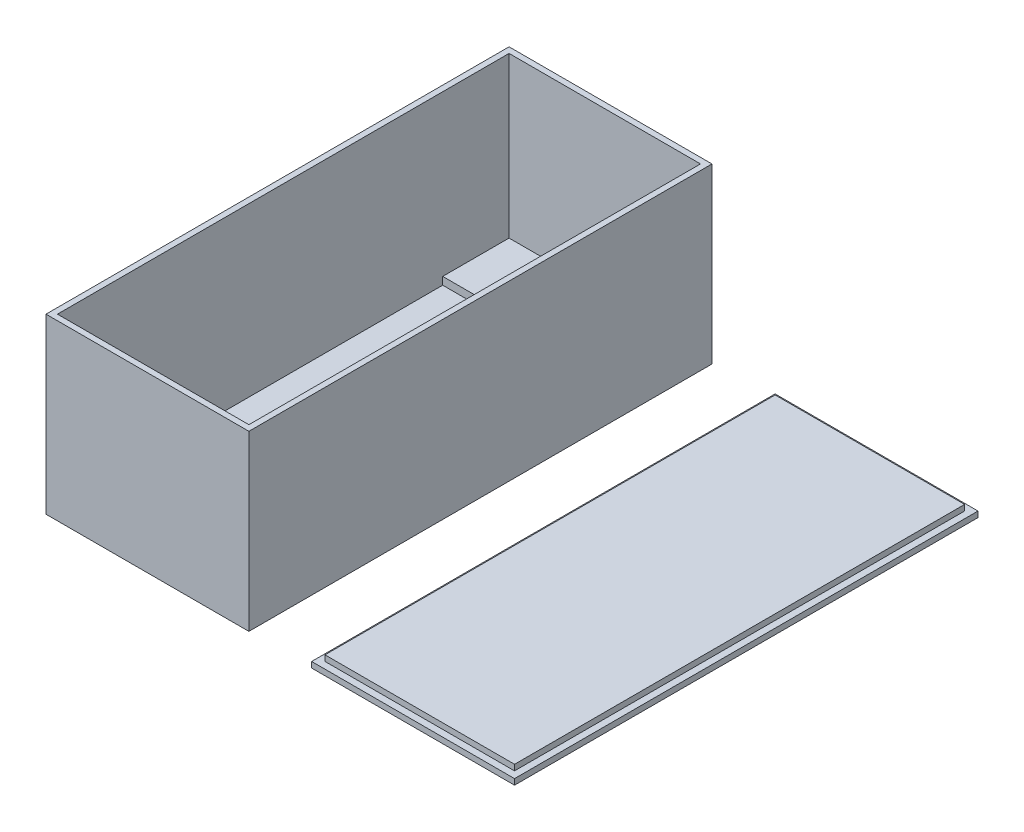
from build123d import *

# Parameters (mm, degrees)
ESBO_O1_W                 = 42.5
ESBO_O1_H                 = 97
RESSALTO_EXTRUS_O2_DEPTH  = 36.3
ESBO_O2_W                 = 40.1
ESBO_O2_H                 = 94.6
CORTE_EXTRUS_O1_DEPTH     = 35.1
ESBO_O3_R                 = 3.4
ESBO_O3_R_2               = 1
ESBO_O3_R_3               = 2.8
CORTE_EXTRUS_O2_DEPTH     = 86.729869764
RESSALTO_EXTRUS_O6_START  = 1.6
ESBO_O5_W                 = 40.1
ESBO_O5_H                 = 13.9
ESBO_O5_R                 = 3.4
ESBO_O5_R_2               = 3.870741489
ESBO_O5_R_3               = 6.1
RESSALTO_EXTRUS_O6_DEPTH  = 1.6
RESSALTO_EXTRUS_O8_START  = 6
ESBO_O5_7_R               = 3.870741489
ESBO_O5_7_R_2             = 2.8
ESBO_O5_7_R_3             = 6.9
ESBO_O5_7_R_4             = 6.1
RESSALTO_EXTRUS_O8_DEPTH  = 6
ESBO_O6_W                 = 42.5
ESBO_O6_H                 = 97.082250683
RESSALTO_EXTRUS_O11_DEPTH = 1.2
ESBO_O6_4_W               = 39.7
ESBO_O6_4_H               = 94.282250683
RESSALTO_EXTRUS_O12_DEPTH = 1.2
ESBO_O6_5_W               = 39.7
ESBO_O6_5_H               = 94.282250683
RESSALTO_EXTRUS_O13_DEPTH = 2.4
ESBO_O1_8_R               = 1.6
ESBO_O1_8_W               = 1.5
ESBO_O1_8_H               = 3
CORTE_EXTRUS_O10_DEPTH    = 87.274966516
ESBO_O1_10_W              = 14.256
ESBO_O1_10_H              = 5.4
ESBO_O1_10_W_2            = 1.5
ESBO_O1_10_H_2            = 3
ESBO_O1_10_W_3            = 6
ESBO_O1_10_H_3            = 15.2
ESBO_O1_10_R              = 1.6
RESSALTO_EXTRUS_O14_DEPTH = 2.8


with BuildPart() as part:
    # Esboço1 → Ressalto-extrusão2 (new body)
    with BuildSketch(Plane(origin=(0, 0, 0), x_dir=(1, 0, 0), z_dir=(0, 1, 0))):
        with Locations((-39.655491882, -0.572615871)):
            Rectangle(ESBO_O1_W, ESBO_O1_H)
    extrude(amount=RESSALTO_EXTRUS_O2_DEPTH)

    # Esboço2 → Corte-extrusão1 (cut)
    with BuildSketch(Plane(origin=(0, 36.3, 0), x_dir=(1, 0, 0), z_dir=(0, 1, 0))):
        with Locations((-39.655491882, -0.572615871)):
            Rectangle(ESBO_O2_W, ESBO_O2_H)
    extrude(amount=-CORTE_EXTRUS_O1_DEPTH, mode=Mode.SUBTRACT)

    # Esboço3 → Corte-extrusão2 (cut, through all)
    with BuildSketch(Plane(origin=(0, 1.2, 0), x_dir=(1, 0, 0), z_dir=(0, 1, 0))):
        with Locations((-49.680491882, 39.727384129)):
            Circle(ESBO_O3_R)
        with Locations((-29.630491882, 39.727384129)):
            Circle(ESBO_O3_R_2)
        with Locations((-39.655491882, 39.727384129)):
            Circle(ESBO_O3_R_3)
    extrude(amount=-CORTE_EXTRUS_O2_DEPTH, mode=Mode.SUBTRACT)

    # Esboço5 → Ressalto-extrusão6 (add)
    with BuildSketch(Plane(origin=(0, 1.2, 0), x_dir=(1, 0, 0), z_dir=(0, 1, 0)).offset(RESSALTO_EXTRUS_O6_START)):
        with Locations((-39.655491882, 39.777384129)):
            Rectangle(ESBO_O5_W, ESBO_O5_H)
        with Locations((-49.680491882, 39.727384129)):
            Circle(ESBO_O5_R, mode=Mode.SUBTRACT)
        with Locations((-39.655491882, 39.727384129)):
            Circle(ESBO_O5_R_2, mode=Mode.SUBTRACT)
        with Locations((-29.630491882, 39.727384129)):
            Circle(ESBO_O5_R_3, mode=Mode.SUBTRACT)
    extrude(amount=-RESSALTO_EXTRUS_O6_DEPTH)

    # Esboço5<7> → Ressalto-extrusão8 (add)
    # profile 1 of 2: a face of its own
    with BuildSketch(Plane(origin=(0, 1.2, 0), x_dir=(1, 0, 0), z_dir=(0, 1, 0)).offset(RESSALTO_EXTRUS_O8_START)):
        with Locations((-39.655491882, 39.727384129)):
            Circle(ESBO_O5_7_R)
        with Locations((-39.655491882, 39.727384129)):
            Circle(ESBO_O5_7_R_2, mode=Mode.SUBTRACT)
    # profile 2 of 2: a face of its own
    with BuildSketch(Plane(origin=(0, 1.2, 0), x_dir=(1, 0, 0), z_dir=(0, 1, 0)).offset(RESSALTO_EXTRUS_O8_START)):
        with Locations((-29.630491882, 39.727384129)):
            Circle(ESBO_O5_7_R_3)
        with Locations((-29.630491882, 39.727384129)):
            Circle(ESBO_O5_7_R_4, mode=Mode.SUBTRACT)
    extrude(amount=-RESSALTO_EXTRUS_O8_DEPTH)

    # Esboço1<8> → Corte-extrusão10 (cut, through all)
    with BuildSketch(Plane(origin=(0, 0, 0), x_dir=(1, 0, 0), z_dir=(0, 1, 0))):
        with Locations((-39.655491882, -37.072615871)):
            Circle(ESBO_O1_8_R)
        with Locations((-43.405491882, -42.572615871)):
            Rectangle(ESBO_O1_8_W, ESBO_O1_8_H)
        with Locations((-35.905491882, -42.572615871)):
            Rectangle(ESBO_O1_8_W, ESBO_O1_8_H)
    extrude(amount=CORTE_EXTRUS_O10_DEPTH, mode=Mode.SUBTRACT)

    # Esboço1<10> → Ressalto-extrusão14 (add)
    # profile 1 of 2: a face of its own
    with BuildSketch(Plane(origin=(0, 0, 0), x_dir=(1, 0, 0), z_dir=(0, 1, 0))):
        with Locations((-39.655491882, -42.572615871)):
            Rectangle(ESBO_O1_10_W, ESBO_O1_10_H)
        with Locations((-43.405491882, -42.572615871)):
            Rectangle(ESBO_O1_10_W_2, ESBO_O1_10_H_2, mode=Mode.SUBTRACT)
        with Locations((-35.905491882, -42.572615871)):
            Rectangle(ESBO_O1_10_W_2, ESBO_O1_10_H_2, mode=Mode.SUBTRACT)
    # profile 2 of 2: a face of its own
    with BuildSketch(Plane(origin=(0, 0, 0), x_dir=(1, 0, 0), z_dir=(0, 1, 0))):
        with Locations((-39.655491882, -41.472615871)):
            Rectangle(ESBO_O1_10_W_3, ESBO_O1_10_H_3)
        with Locations((-39.655491882, -37.072615871)):
            Circle(ESBO_O1_10_R, mode=Mode.SUBTRACT)
    extrude(amount=RESSALTO_EXTRUS_O14_DEPTH)


with BuildPart() as body_2:
    # Esboço6 → Ressalto-extrusão11 (new body)
    with BuildSketch(Plane(origin=(0, 0, 0), x_dir=(1, 0, 0), z_dir=(0, 1, 0))):
        with Locations((16.069563731, -0.613741212)):
            Rectangle(ESBO_O6_W, ESBO_O6_H)
    extrude(amount=RESSALTO_EXTRUS_O11_DEPTH)

    # Esboço6<4> → Ressalto-extrusão12 (add)
    with BuildSketch(Plane(origin=(0, 0, 0), x_dir=(1, 0, 0), z_dir=(0, 1, 0))):
        with Locations((16.069563731, -0.613741212)):
            Rectangle(ESBO_O6_4_W, ESBO_O6_4_H)
    extrude(amount=RESSALTO_EXTRUS_O12_DEPTH)

    # Esboço6<5> → Ressalto-extrusão13 (add)
    with BuildSketch(Plane(origin=(0, 0, 0), x_dir=(1, 0, 0), z_dir=(0, 1, 0))):
        with Locations((16.069563731, -0.613741212)):
            Rectangle(ESBO_O6_5_W, ESBO_O6_5_H)
    extrude(amount=RESSALTO_EXTRUS_O13_DEPTH)


solid = Compound([part.part, body_2.part])
